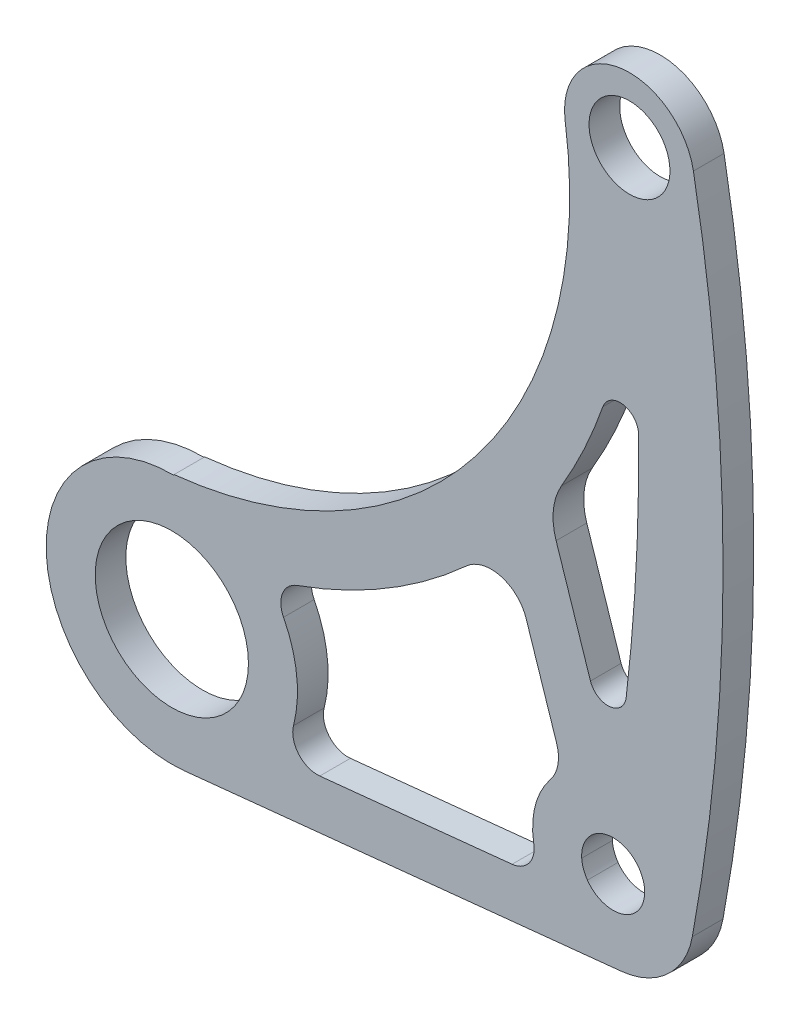
from build123d import *

# Parameters (mm, degrees)
SKETCH2_R           = 7.9375
SKETCH2_R_2         = 3.2639
SKETCH2_R_3         = 4.191
BOSS_EXTRUDE1_DEPTH = 3.175
FILLET1_R           = 2.54
FILLET2_R           = 3.81
FILLET3_R           = 1.905
FILLET4_R           = 6.35


with BuildPart() as part:
    # Sketch2 → Boss-Extrude1 (new body)
    with BuildSketch(Plane.XY):
        with BuildLine():
            ThreePointArc((54.035830718, 67.22198524), (46.333024889, 72.662028043), (40.750647472, 65.061742146))
            ThreePointArc((40.750647472, 65.061742146), (31.550758366, 30.452598432), (0.230104832, 13.090356345))
            Line((0.230104832, 13.090356345), (0.171615761, 13.016368706))
            ThreePointArc((0.171615761, 13.016368706), (-13.004550196, -0.580500165), (1.330677778, -12.949308974))
            Line((1.330677778, -12.949308974), (46.572932, -8.300191215))
            ThreePointArc((46.572932, -8.300191215), (51.37742802, -6.133039654), (53.924522362, -1.518709983))
            ThreePointArc((53.924522362, -1.518709983), (57.106411985, 32.846575472), (54.035830718, 67.22198524))
        make_face()
        Circle(SKETCH2_R, mode=Mode.SUBTRACT)
        with BuildLine():
            ThreePointArc((9.848859751, 8.512066016), (23.445327069, 14.632175726), (34.749899024, 24.354640398))
            Line((34.749899024, 24.354640398), (40.595697266, 6.584997244))
            ThreePointArc((40.595697266, 6.584997244), (37.546758205, 1.678923993), (38.414831114, -4.031770672))
            Line((38.414831114, -4.031770672), (11.074870198, -6.841239387))
            ThreePointArc((11.074870198, -6.841239387), (12.976194182, 1.036190528), (9.848859751, 8.512066016))
        make_face(mode=Mode.SUBTRACT)
        with Locations((45.72, 0)):
            Circle(SKETCH2_R_2, mode=Mode.SUBTRACT)
        with BuildLine():
            Line((45.933946154, 8.34115665), (38.882442516, 29.775817606))
            ThreePointArc((38.882442516, 29.775817606), (45.039190515, 42.544935267), (47.523781163, 56.501393309))
            ThreePointArc((47.523781163, 56.501393309), (48.257752726, 32.370804269), (45.933946154, 8.34115665))
        make_face(mode=Mode.SUBTRACT)
        with Locations((47.413333333, 66.018287029)):
            Circle(SKETCH2_R_3, mode=Mode.SUBTRACT)
    extrude(amount=BOSS_EXTRUDE1_DEPTH)

    # Fillet1
    fillet1_edges = [part.edges().sort_by_distance(p)[0] for p in [
        (38.414831114, -4.031770672, 1.5875),
        (9.848859751, 8.512066016, 1.5875),
        (11.074870198, -6.841239387, 1.5875),
    ]]
    fillet(fillet1_edges, radius=FILLET1_R)

    # Fillet2
    fillet2_edges = [part.edges().sort_by_distance(p)[0] for p in [
        (40.595697266, 6.584997244, 1.5875),
        (34.749899024, 24.354640398, 1.5875),
    ]]
    fillet(fillet2_edges, radius=FILLET2_R)

    # Fillet3
    fillet3_edges = [part.edges().sort_by_distance(p)[0] for p in [
        (47.523781163, 56.501393309, 1.5875),
        (45.933946154, 8.34115665, 1.5875),
    ]]
    fillet(fillet3_edges, radius=FILLET3_R)

    # Fillet4
    fillet4_edges = [part.edges().sort_by_distance(p)[0] for p in [
        (38.882442516, 29.775817606, 1.5875),
    ]]
    fillet(fillet4_edges, radius=FILLET4_R)


solid = part.part
